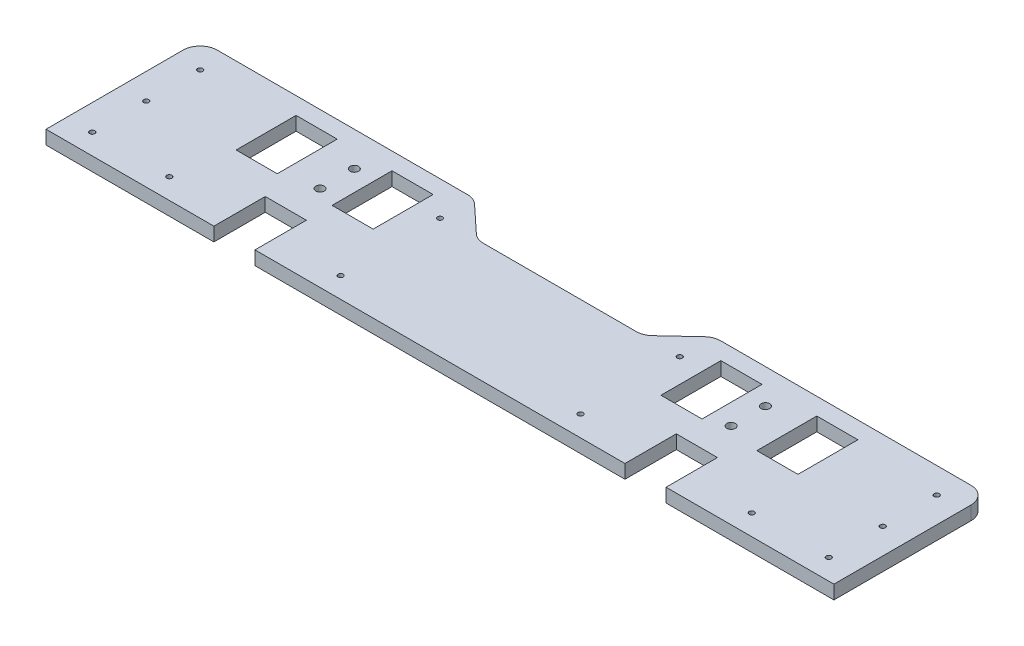
from build123d import *

# Parameters (mm, degrees)
SKETCH_1_W          = 460
SKETCH_1_H          = 90
EXTRUDE_1_DEPTH     = 8
SKETCH_3_W          = 24
SKETCH_3_H          = 30
CUT_EXTRUDE_2_DEPTH = 235.49733474
SKETCH_2_W          = 24
SKETCH_2_H          = 35
CUT_EXTRUDE_3_DEPTH = 235.49733474
FILLET_1_R          = 10
SKETCH_19_R         = 2.5
CUT_EXTRUDE_4_DEPTH = 235.49733474
SKETCH_20_R         = 1.5
CUT_EXTRUDE_5_DEPTH = 235.49733474


with BuildPart() as part:
    # 草图1 → 凸台-拉伸1 (new body)
    with BuildSketch(Plane(origin=(0, 0, 0), x_dir=(1, 0, 0), z_dir=(0, 1, 0))):
        Rectangle(SKETCH_1_W, SKETCH_1_H)
    extrude(amount=EXTRUDE_1_DEPTH)

    # 草图3 → 切除-拉伸2 (cut, through all)
    with BuildSketch(Plane(origin=(0, 8, 0), x_dir=(1, 0, 0), z_dir=(0, 1, 0))):
        with Locations((120, -30)):
            Rectangle(SKETCH_3_W, SKETCH_3_H)
        Polygon((-70, 45), (70, 45), (48.5526258, 25), (-48.5526258, 25), align=None)
    cut_extrude_2 = extrude(amount=-CUT_EXTRUDE_2_DEPTH, mode=Mode.SUBTRACT)

    # 草图2 → 切除-拉伸3 (cut, through all)
    with BuildSketch(Plane(origin=(0, 8, 0), x_dir=(1, 0, 0), z_dir=(0, 1, 0))):
        with Locations((152, 17.5)):
            Rectangle(SKETCH_2_W, SKETCH_2_H)
        with Locations((96, 17.5)):
            Rectangle(SKETCH_2_W, SKETCH_2_H)
    cut_extrude_3 = extrude(amount=-CUT_EXTRUDE_3_DEPTH, mode=Mode.SUBTRACT)

    # 镜向1: 切除-拉伸2, 切除-拉伸3 across plane
    add(cut_extrude_2.mirror(Plane(origin=(0, 0, 0), x_dir=(0, 0, 1), z_dir=(1, 0, 0))), mode=Mode.SUBTRACT)
    add(cut_extrude_3.mirror(Plane(origin=(0, 0, 0), x_dir=(0, 0, 1), z_dir=(1, 0, 0))), mode=Mode.SUBTRACT)

    # 圆角1
    fillet_1_edges = [part.edges().sort_by_distance(p)[0] for p in [
        (-48.5526258, 4, -25),
        (-70, 4, -45),
        (70, 4, -45),
        (48.5526258, 4, -25),
        (-230, 4, -45),
        (230, 4, -45),
    ]]
    fillet(fillet_1_edges, radius=FILLET_1_R)

    # 草图19 → 切除-拉伸4 (cut, through all)
    with BuildSketch(Plane(origin=(0, 8, 0), x_dir=(1, 0, 0), z_dir=(0, 1, 0))):
        with Locations(Location((-120, 5, 0), (0, 0, 270))):
            Circle(SKETCH_19_R)
        with Locations(Location((-120, 25, 0), (0, 0, 270))):
            Circle(SKETCH_19_R)
    cut_extrude_4 = extrude(amount=-CUT_EXTRUDE_4_DEPTH, mode=Mode.SUBTRACT)

    # 镜向2: 切除-拉伸4 across plane
    add(cut_extrude_4.mirror(Plane(origin=(0, 0, 0), x_dir=(0, 0, 1), z_dir=(1, 0, 0))), mode=Mode.SUBTRACT)

    # 草图20 → 切除-拉伸5 (cut, through all)
    with BuildSketch(Plane(origin=(0, 8, 0), x_dir=(1, 0, 0), z_dir=(0, 1, 0))):
        with Locations(Location((-215, 30, 0), (0, 0, 270))):
            Circle(SKETCH_20_R)
        with Locations(Location((-215, -1.5, 0), (0, 0, 270))):
            Circle(SKETCH_20_R)
        with Locations(Location((-215, -33, 0), (0, 0, 270))):
            Circle(SKETCH_20_R)
        with Locations(Location((-70, 25, 0), (0, 0, 270))):
            Circle(SKETCH_20_R)
        with Locations(Location((-70, -33, 0), (0, 0, 270))):
            Circle(SKETCH_20_R)
        with Locations(Location((-170, -33, 0), (0, 0, 270))):
            Circle(SKETCH_20_R)
    cut_extrude_5 = extrude(amount=-CUT_EXTRUDE_5_DEPTH, mode=Mode.SUBTRACT)

    # 镜向3: 切除-拉伸5 across plane
    add(cut_extrude_5.mirror(Plane(origin=(0, 0, 0), x_dir=(0, 0, 1), z_dir=(1, 0, 0))), mode=Mode.SUBTRACT)


solid = part.part
